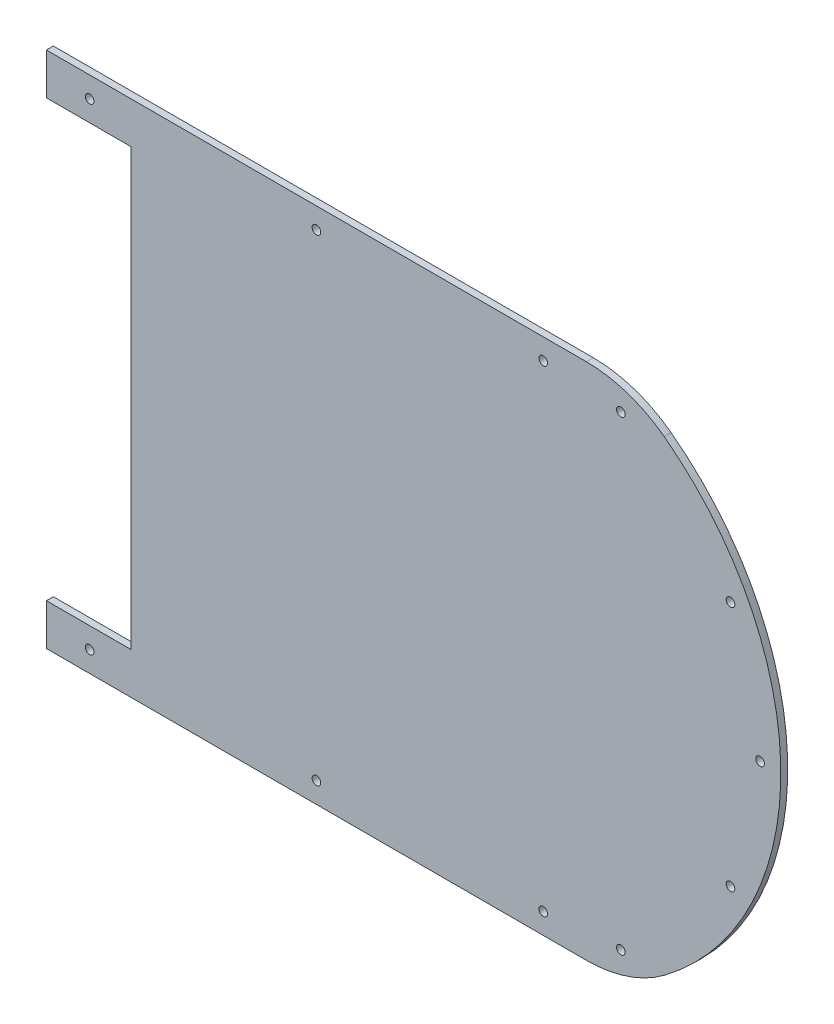
from build123d import *

# Parameters (mm, degrees)
SKETCH1_R           = 2.5
BOSS_EXTRUDE1_DEPTH = 4


with BuildPart() as part:
    # Sketch1 → Boss-Extrude1 (new body)
    with BuildSketch(Plane.XY):
        with BuildLine():
            Line((0, -122.474747475), (312.5, -122.474747475))
            ThreePointArc((312.5, -122.474747475), (336.217082451, -118.625994829), (357.5, -107.474747475))
            ThreePointArc((357.5, -107.474747475), (425, 27.525252525), (357.5, 162.525252525))
            ThreePointArc((357.5, 162.525252525), (336.217082451, 173.676499879), (312.5, 177.525252525))
            Line((312.5, 177.525252525), (0, 177.525252525))
            Line((0, 177.525252525), (0, 153.525252525))
            Line((0, 153.525252525), (49, 153.525252525))
            Line((49, 153.525252525), (49, -98.474747475))
            Line((49, -98.474747475), (0, -98.474747475))
            Line((0, -98.474747475), (0, -122.474747475))
        make_face()
        with Locations((25, 165.525252525)):
            Circle(SKETCH1_R, mode=Mode.SUBTRACT)
        with Locations((156.25, 165.525252525)):
            Circle(SKETCH1_R, mode=Mode.SUBTRACT)
        with Locations((287.5, 165.525252525)):
            Circle(SKETCH1_R, mode=Mode.SUBTRACT)
        with Locations((332.422349259, 162.292300302)):
            Circle(SKETCH1_R, mode=Mode.SUBTRACT)
        with Locations((395.887987253, 98.741788638)):
            Circle(SKETCH1_R, mode=Mode.SUBTRACT)
        with Locations((413, 27.525252525)):
            Circle(SKETCH1_R, mode=Mode.SUBTRACT)
        with Locations((395.887987253, -43.691283587)):
            Circle(SKETCH1_R, mode=Mode.SUBTRACT)
        with Locations((332.422349259, -107.241795252)):
            Circle(SKETCH1_R, mode=Mode.SUBTRACT)
        with Locations((287.5, -110.474747475)):
            Circle(SKETCH1_R, mode=Mode.SUBTRACT)
        with Locations((156.25, -110.474747475)):
            Circle(SKETCH1_R, mode=Mode.SUBTRACT)
        with Locations((25, -110.474747475)):
            Circle(SKETCH1_R, mode=Mode.SUBTRACT)
    extrude(amount=BOSS_EXTRUDE1_DEPTH)


solid = part.part
